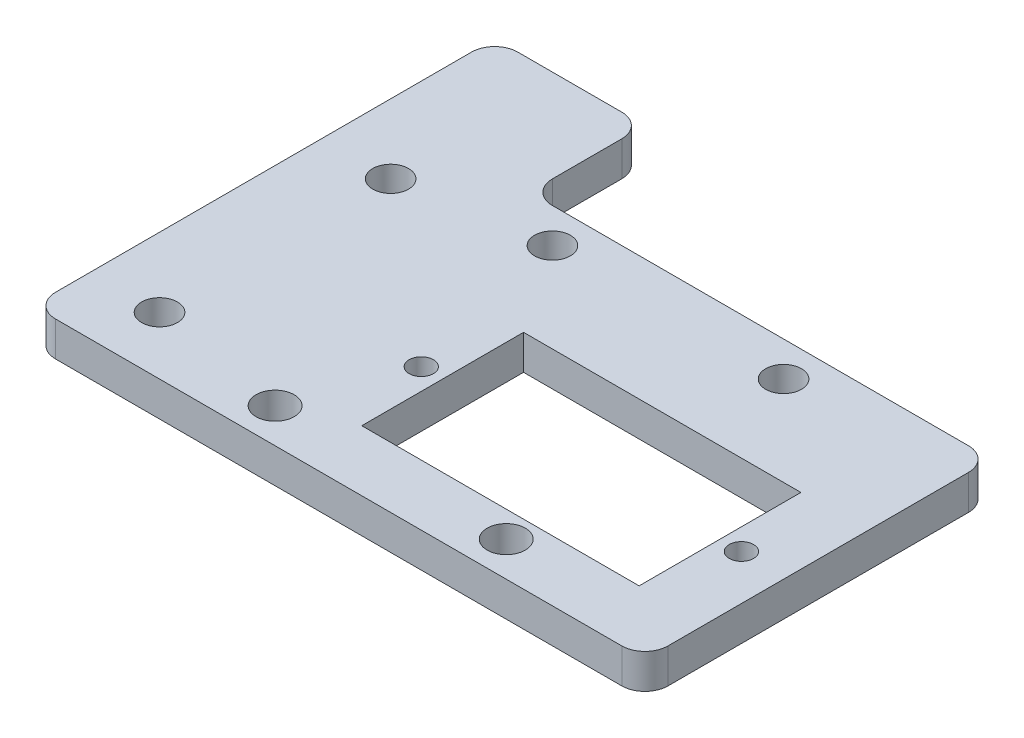
from build123d import *

# Parameters (mm, degrees)
SKETCH_1_W          = 53
SKETCH_1_H          = 40
EXTRUDE_1_DEPTH     = 3
SKETCH_2_R          = 1.55
CUT_EXTRUDE_1_DEPTH = 10
SKETCH_4_R          = 1.65
CUT_EXTRUDE_2_DEPTH = 10
SKETCH_5_R          = 1.05
CUT_EXTRUDE_3_DEPTH = 10
SKETCH_6_W          = 23
SKETCH_6_H          = 12.5
CUT_EXTRUDE_4_DEPTH = 10
SKETCH_7_W          = 24
SKETCH_7_H          = 14
CUT_EXTRUDE_5_DEPTH = 10
SKETCH_8_W          = 40
SKETCH_8_H          = 10
CUT_EXTRUDE_6_DEPTH = 10
SKETCH_9_R          = 1.55
CUT_EXTRUDE_7_DEPTH = 10
FILLET_1_R          = 2


with BuildPart() as part:
    # 草图1 → 凸台-拉伸1 (new body)
    with BuildSketch(Plane(origin=(0, 0, 0), x_dir=(1, 0, 0), z_dir=(0, 1, 0))):
        Rectangle(SKETCH_1_W, SKETCH_1_H)
    extrude(amount=EXTRUDE_1_DEPTH)

    # 草图2 → 切除-拉伸1 (cut)
    with BuildSketch(Plane(origin=(0, 0, 0), x_dir=(-1, 0, 0), z_dir=(0, -1, 0))):
        with Locations(Location((20.5, -15, 0), (0, 0, 90))):
            Circle(SKETCH_2_R)
        with Locations(Location((20.5, 5, 0), (0, 0, 90))):
            Circle(SKETCH_2_R)
    extrude(amount=-CUT_EXTRUDE_1_DEPTH, mode=Mode.SUBTRACT)

    # 草图4 → 切除-拉伸2 (cut)
    with BuildSketch(Plane(origin=(0, 3, 0), x_dir=(1, 0, 0), z_dir=(0, 1, 0))):
        with Locations(Location((-8.5, -17, 0), (0, 0, 270))):
            Circle(SKETCH_4_R)
        with Locations(Location((11.5, -17, 0), (0, 0, 270))):
            Circle(SKETCH_4_R)
        with Locations(Location((-0.5, 17, 0), (0, 0, 270))):
            Circle(SKETCH_4_R)
        with Locations(Location((19.5, 17, 0), (0, 0, 270))):
            Circle(SKETCH_4_R)
    extrude(amount=-CUT_EXTRUDE_2_DEPTH, mode=Mode.SUBTRACT)

    # 草图5 → 切除-拉伸3 (cut)
    with BuildSketch(Plane(origin=(0, 3, 0), x_dir=(1, 0, 0), z_dir=(0, 1, 0))):
        with Locations(Location((22.599975, -7.75, 0), (0, 0, 270))):
            Circle(SKETCH_5_R)
        with Locations(Location((-5.100025, -7.75, 0), (0, 0, 270))):
            Circle(SKETCH_5_R)
    extrude(amount=-CUT_EXTRUDE_3_DEPTH, mode=Mode.SUBTRACT)

    # 草图6 → 切除-拉伸4 (cut)
    with BuildSketch(Plane(origin=(0, 0, 0), x_dir=(-1, 0, 0), z_dir=(0, -1, 0))):
        with Locations((-8.749975, -7.75)):
            Rectangle(SKETCH_6_W, SKETCH_6_H)
    extrude(amount=-CUT_EXTRUDE_4_DEPTH, mode=Mode.SUBTRACT)

    # 草图7 → 切除-拉伸5 (cut)
    with BuildSketch(Plane(origin=(0, 0, 0), x_dir=(-1, 0, 0), z_dir=(0, -1, 0))):
        with Locations((-8.749975, -7.75)):
            Rectangle(SKETCH_7_W, SKETCH_7_H)
    extrude(amount=-CUT_EXTRUDE_5_DEPTH, mode=Mode.SUBTRACT)

    # 草图8 → 切除-拉伸6 (cut)
    with BuildSketch(Plane(origin=(0, 0, 0), x_dir=(-1, 0, 0), z_dir=(0, -1, 0))):
        with Locations((-6.5, 15)):
            Rectangle(SKETCH_8_W, SKETCH_8_H)
    extrude(amount=-CUT_EXTRUDE_6_DEPTH, mode=Mode.SUBTRACT)

    # 草图9 → 切除-拉伸7 (cut)
    with BuildSketch(Plane(origin=(0, 0, 0), x_dir=(-1, 0, 0), z_dir=(0, -1, 0))):
        with Locations(Location((-11.5, 7, 0), (0, 0, 90))):
            Circle(SKETCH_9_R)
        with Locations(Location((8.5, 7, 0), (0, 0, 90))):
            Circle(SKETCH_9_R)
    extrude(amount=-CUT_EXTRUDE_7_DEPTH, mode=Mode.SUBTRACT)

    # 圆角1
    fillet_1_edges = [part.edges().sort_by_distance(p)[0] for p in [
        (26.5, 1.5, -10),
        (-13.5, 1.5, -20),
        (-13.5, 1.5, -10),
        (26.5, 1.5, 20),
        (-26.5, 1.5, 20),
        (-26.5, 1.5, -20),
    ]]
    fillet(fillet_1_edges, radius=FILLET_1_R)


solid = part.part
